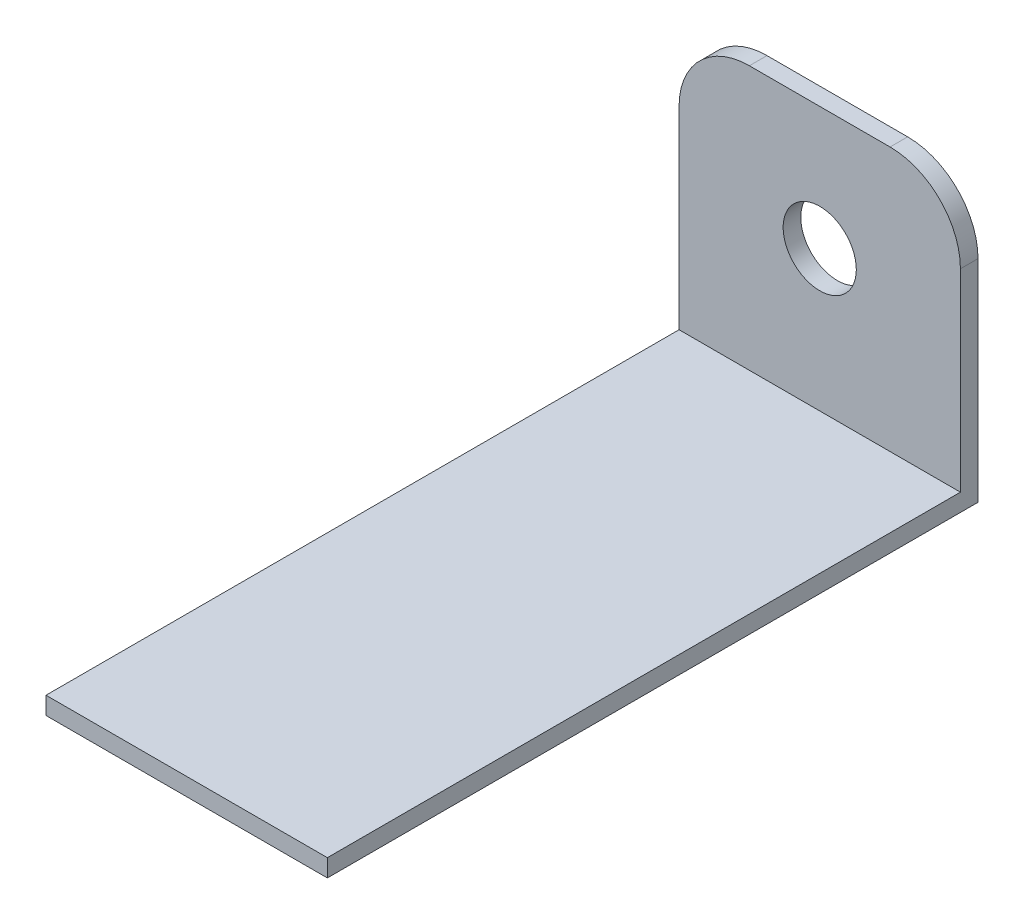
from build123d import *

# Parameters (mm, degrees)
SKETCH1_W           = 25.4
SKETCH1_H           = 57.15
BOSS_EXTRUDE1_DEPTH = 1.5875
SKETCH2_W           = 25.4
SKETCH2_H           = 25.4
BOSS_EXTRUDE2_DEPTH = 1.5875
SKETCH3_R           = 3.302
CUT_EXTRUDE1_DEPTH  = 68.501425911
FILLET1_R           = 6.35


with BuildPart() as part:
    # Sketch1 → Boss-Extrude1 (new body)
    with BuildSketch(Plane(origin=(0, 0, 0), x_dir=(1, 0, 0), z_dir=(0, 1, 0))):
        with Locations((12.7, 28.575)):
            Rectangle(SKETCH1_W, SKETCH1_H)
    extrude(amount=BOSS_EXTRUDE1_DEPTH)

    # Sketch2 → Boss-Extrude2 (add)
    with BuildSketch(Plane(origin=(0, 0, -57.15), x_dir=(-1, 0, 0), z_dir=(0, 0, -1))):
        with Locations((-12.7, 12.7)):
            Rectangle(SKETCH2_W, SKETCH2_H)
    extrude(amount=BOSS_EXTRUDE2_DEPTH)

    # Sketch3 → Cut-Extrude1 (cut, through all)
    with BuildSketch(Plane.XY.offset(-57.15)):
        with Locations((12.7, 14.2875)):
            Circle(SKETCH3_R)
    extrude(amount=-CUT_EXTRUDE1_DEPTH, mode=Mode.SUBTRACT)

    # Fillet1
    fillet1_edges = [part.edges().sort_by_distance(p)[0] for p in [
        (25.4, 25.4, -57.94375),
        (0, 25.4, -57.94375),
    ]]
    fillet(fillet1_edges, radius=FILLET1_R)


solid = part.part
